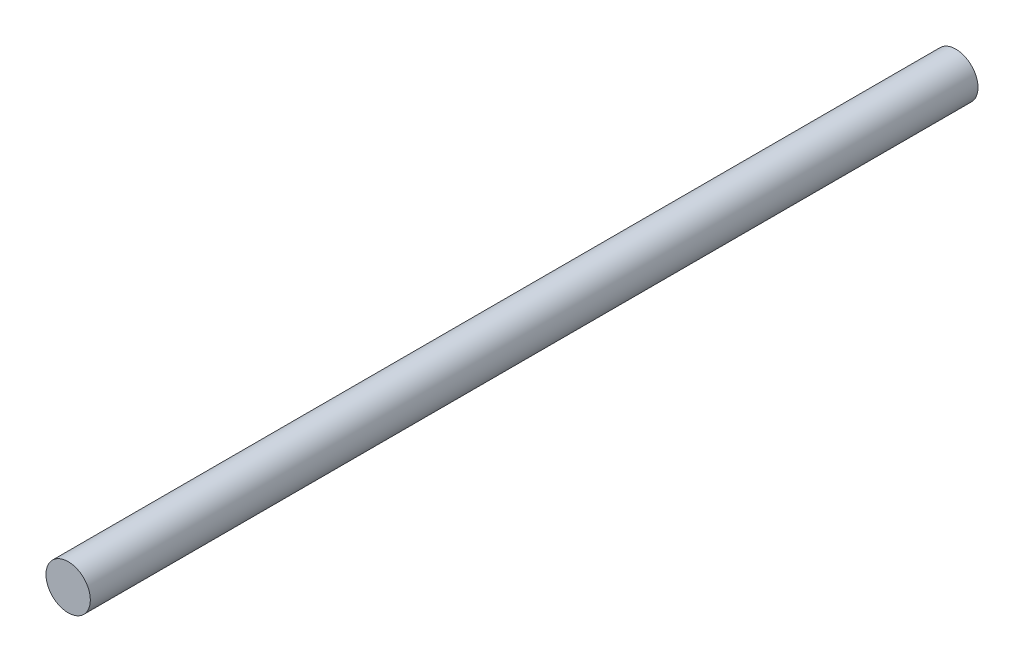
from build123d import *

# Parameters (mm, degrees)
ESQUISSE1_R        = 4
BOSS_EXTRU_1_DEPTH = 160


with BuildPart() as part:
    # Esquisse1 → Boss.-Extru.1 (new body)
    with BuildSketch(Plane.XY):
        Circle(ESQUISSE1_R)
    extrude(amount=BOSS_EXTRU_1_DEPTH)


solid = part.part
